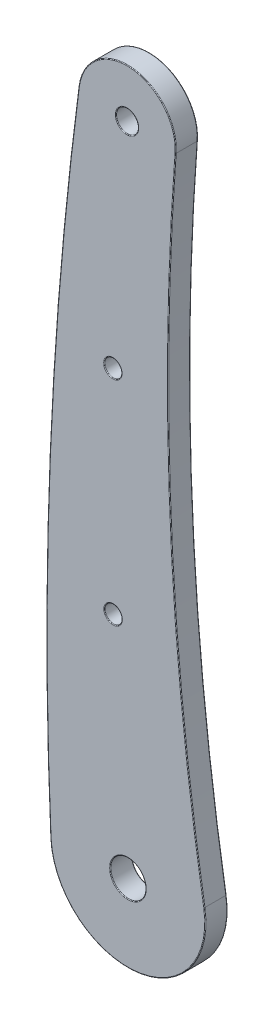
from build123d import *

# Parameters (mm, degrees)
SKETCH7_R                  = 2.5
SKETCH7_R_2                = 4
BOSS_EXTRUDE1_DEPTH        = 5
M3_5_CLEARANCE_HOLE1_D     = 3.9
M3_5_CLEARANCE_HOLE1_DEPTH = 10
M3_5_CLEARANCE_HOLE1_TIP   = 1.171678207
FILLET1_R                  = 0.15


with BuildPart() as part:
    # Sketch7 → Boss-Extrude1 (new body)
    with BuildSketch(Plane.XY):
        with BuildLine():
            ThreePointArc((-5.126903148, 337.826095833), (-6.240213511, 265.488527819), (1.360942505, 193.54281472))
            ThreePointArc((1.360942505, 193.54281472), (-14.050586097, 173.256252394), (-33.381070722, 189.851197076))
            ThreePointArc((-33.381070722, 189.851197076), (-33.52020826, 265.114554689), (-27.0011198, 340.095177812))
            ThreePointArc((-27.0011198, 340.095177812), (-14.960413811, 349.599447844), (-5.126903148, 337.826095833))
        make_face()
        with Locations((-16.095388605, 338.658157599)):
            Circle(SKETCH7_R, mode=Mode.SUBTRACT)
        with Locations((-15.89969189, 190.658286981)):
            Circle(SKETCH7_R_2, mode=Mode.SUBTRACT)
    extrude(amount=-BOSS_EXTRUDE1_DEPTH)

    # M3.5 Clearance Hole1
    with Locations(Plane.XY):
        with Locations((-19.241445362, 240.658286981), (-19.301185724, 288.770312626)):
            Hole(M3_5_CLEARANCE_HOLE1_D / 2, depth=M3_5_CLEARANCE_HOLE1_DEPTH)
            with Locations((0, 0, -(M3_5_CLEARANCE_HOLE1_DEPTH + M3_5_CLEARANCE_HOLE1_TIP / 2))):  # 118° drill point
                Cone(0, M3_5_CLEARANCE_HOLE1_D / 2, M3_5_CLEARANCE_HOLE1_TIP, mode=Mode.SUBTRACT)

    # Fillet1
    fillet1_edges = [part.edges().sort_by_distance(p)[0] for p in [
        (-14.050586097, 173.256252394, -5),
        (-18.595388605, 338.658157599, -5),
        (-18.595388605, 338.658157599, 0),
        (-6.240213511, 265.488527819, -5),
        (-19.89969189, 190.658286981, -5),
        (-19.89969189, 190.658286981, 0),
        (-17.351185724, 288.770312626, -5),
        (-17.351185724, 288.770312626, 0),
        (-17.291445362, 240.658286981, -5),
        (-17.291445362, 240.658286981, 0),
        (-14.960413811, 349.599447844, -5),
        (-6.240213511, 265.488527819, 0),
        (-14.050586097, 173.256252394, 0),
        (-33.52020826, 265.114554689, 0),
        (-14.960413811, 349.599447844, 0),
        (-33.52020826, 265.114554689, -5),
    ]]
    fillet(fillet1_edges, radius=FILLET1_R)


solid = part.part
